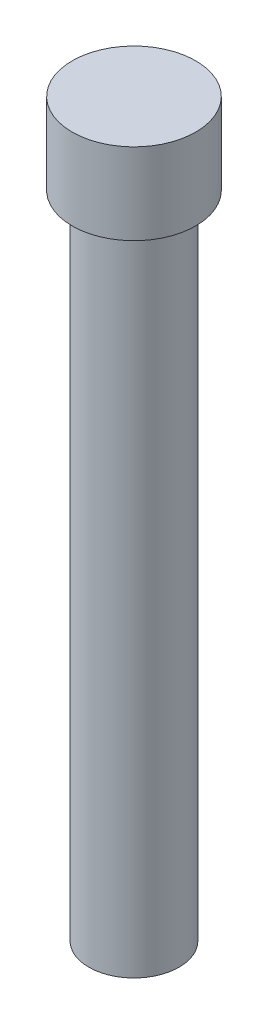
from build123d import *

# Parameters (mm, degrees)
SKETCH1_R           = 1.76403
BOSS_EXTRUDE1_DEPTH = 25.4
SKETCH2_R           = 2.413
BOSS_EXTRUDE2_DEPTH = 3.175


with BuildPart() as part:
    # Sketch1 → Boss-Extrude1 (new body)
    with BuildSketch(Plane(origin=(0, 0, 0), x_dir=(1, 0, 0), z_dir=(0, 1, 0))):
        with Locations(Location((0, 0, 0), (0, 0, 270))):
            Circle(SKETCH1_R)
    extrude(amount=BOSS_EXTRUDE1_DEPTH)

    # Sketch2 → Boss-Extrude2 (add)
    with BuildSketch(Plane(origin=(0, 25.4, 0), x_dir=(1, 0, 0), z_dir=(0, 1, 0))):
        with Locations(Location((0, 0, 0), (0, 0, 270))):
            Circle(SKETCH2_R)
    extrude(amount=BOSS_EXTRUDE2_DEPTH)


solid = part.part
